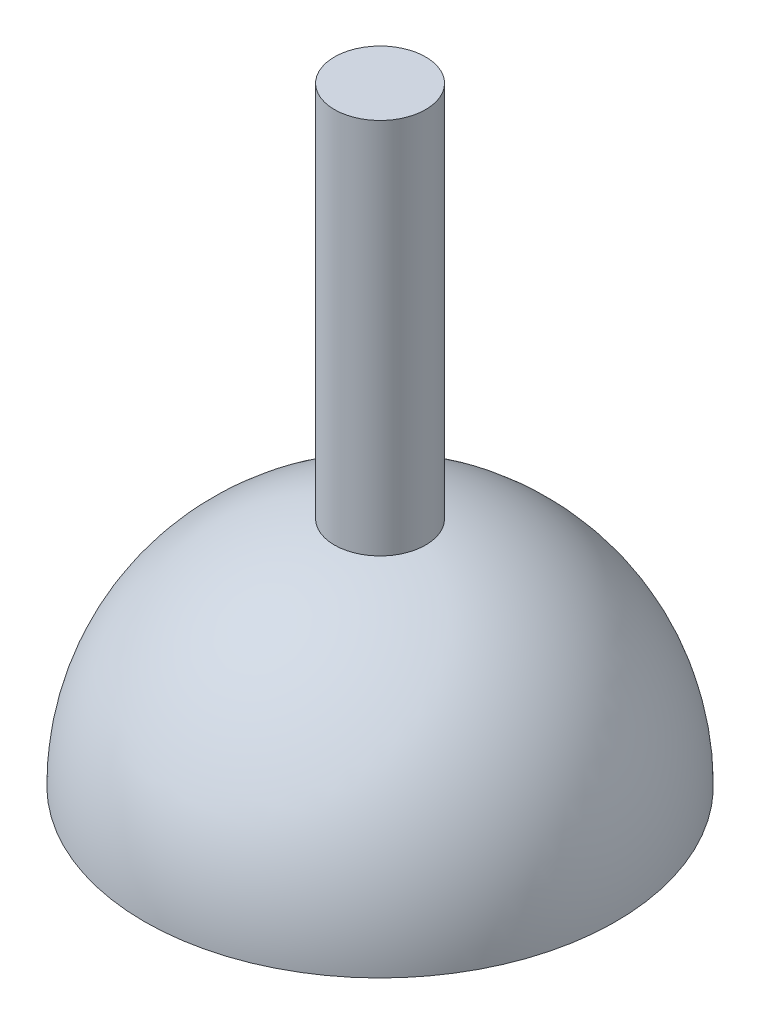
from build123d import *

# Parameters (mm, degrees)
SKETCH4_R           = 31
CUT_EXTRUDE1_DEPTH  = 50
SKETCH6_R           = 6
BOSS_EXTRUDE1_DEPTH = 50


with BuildPart() as part:
    # Sketch2 → Revolve-Thin1 (revolve)
    with BuildSketch(Plane(origin=(0, 0, 0), x_dir=(1, 0, 0), z_dir=(0, 1, 0))):
        with BuildLine():
            ThreePointArc((0, -30), (30, 0), (0, 30))
            Line((0, 30), (0, 31))
            ThreePointArc((0, 31), (31, 0), (0, -31))
            Line((0, -31), (0, -30))
        make_face()
    revolve(axis=Axis((0, 0, 40.153207951), (0, 0, -1)))

    # Sketch4 → Cut-Extrude1 (cut)
    with BuildSketch(Plane(origin=(0, 0, 0), x_dir=(1, 0, 0), z_dir=(0, 1, 0))):
        Circle(SKETCH4_R)
    extrude(amount=-CUT_EXTRUDE1_DEPTH, mode=Mode.SUBTRACT)


with BuildPart() as body_2:
    # Sketch6 → Boss-Extrude1 (new body)
    with BuildSketch(Plane(origin=(0, 30, 0), x_dir=(1, 0, 0), z_dir=(0, 1, 0))):
        with Locations(Location((0, 0, 0), (0, 0, 270))):
            Circle(SKETCH6_R)
    extrude(amount=BOSS_EXTRUDE1_DEPTH)


solid = Compound([part.part, body_2.part])
